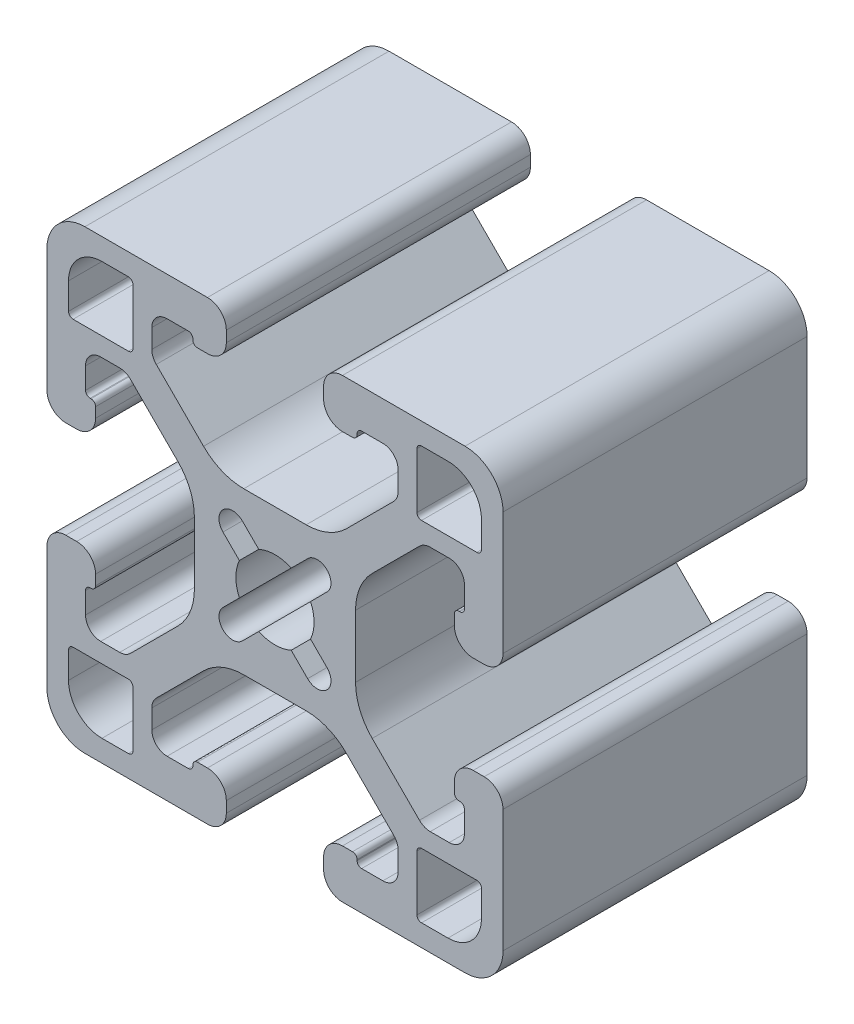
from build123d import *

# Parameters (mm, degrees)
EXTRUDE1_DEPTH = 25.4


with BuildPart() as part:
    # Sketch1 → Extrude1 (new body)
    with BuildSketch(Plane.XY):
        with BuildLine():
            Line((-46.536752228, -7.000622168), (-46.536752228, -8.774580164))
            ThreePointArc((-46.536752228, -8.774580164), (-46.907290083, -9.675221514), (-47.806745776, -10.048628264))
            Line((-47.806745776, -10.048628264), (-49.392633083, -10.048628264))
            ThreePointArc((-49.392633083, -10.048628264), (-49.878641042, -9.95195527), (-50.290658695, -9.676653876))
            Line((-50.290658695, -9.676653876), (-54.238761565, -5.728551005))
            ThreePointArc((-54.238761565, -5.728551005), (-55.26838878, -4.187604983), (-55.629945776, -2.369935216))
            Line((-55.629945776, -2.369935216), (-55.629945776, 2.846678689))
            ThreePointArc((-55.629945776, 2.846678689), (-55.26838878, 4.664348456), (-54.238761565, 6.205294478))
            Line((-54.238761565, 6.205294478), (-50.290658695, 10.153397348))
            ThreePointArc((-50.290658695, 10.153397348), (-49.878641042, 10.428698742), (-49.392633083, 10.525371736))
            Line((-49.392633083, 10.525371736), (-47.806745776, 10.525371736))
            ThreePointArc((-47.806745776, 10.525371736), (-46.907290079, 10.151964982), (-46.536752228, 9.251323623))
            Line((-46.536752228, 9.251323623), (-46.536752228, 7.47736564))
            ThreePointArc((-46.536752228, 7.47736564), (-46.648344767, 7.207957418), (-46.91775299, 7.096364878))
            Line((-46.91775299, 7.096364878), (-46.993953142, 7.096364878))
            ThreePointArc((-46.993953142, 7.096364878), (-47.263362671, 6.984771032), (-47.374953904, 6.715360422))
            Line((-47.374953904, 6.715360422), (-47.374945776, 5.877156465))
            ThreePointArc((-47.374945776, 5.877156465), (-46.913692136, 4.763614578), (-45.800145776, 4.302371736))
            Line((-45.800145776, 4.302371736), (-44.885745776, 4.302371736))
            ThreePointArc((-44.885745776, 4.302371736), (-43.772194017, 4.763619977), (-43.310945776, 5.877171736))
            Line((-43.310945776, 5.877171736), (-43.310945776, 16.113371736))
            ThreePointArc((-43.310945776, 16.113371736), (-44.240881746, 18.358435766), (-46.485945776, 19.288371736))
            Line((-46.485945776, 19.288371736), (-56.722145776, 19.288371736))
            ThreePointArc((-56.722145776, 19.288371736), (-57.835697535, 18.827123495), (-58.296945776, 17.713571736))
            Line((-58.296945776, 17.713571736), (-58.296945776, 16.799171736))
            ThreePointArc((-58.296945776, 16.799171736), (-57.835702934, 15.685625376), (-56.722161047, 15.224371736))
            Line((-56.722161047, 15.224371736), (-55.883957091, 15.224363608))
            ThreePointArc((-55.883957091, 15.224363608), (-55.61454648, 15.335954841), (-55.502952634, 15.60536437))
            Line((-55.502952634, 15.60536437), (-55.502952634, 15.681564523))
            ThreePointArc((-55.502952634, 15.681564523), (-55.391360095, 15.950972745), (-55.121951872, 16.062565285))
            Line((-55.121951872, 16.062565285), (-53.347993876, 16.062565285))
            ThreePointArc((-53.347993876, 16.062565285), (-52.447352526, 15.692027429), (-52.073945776, 14.792571736))
            Line((-52.073945776, 14.792571736), (-52.073945776, 13.206684429))
            ThreePointArc((-52.073945776, 13.206684429), (-52.17061877, 12.72067647), (-52.445920164, 12.308658817))
            Line((-52.445920164, 12.308658817), (-56.394023034, 8.360555947))
            ThreePointArc((-56.394023034, 8.360555947), (-57.934969057, 7.330928733), (-59.752638824, 6.969371736))
            Line((-59.752638824, 6.969371736), (-64.969252728, 6.969371736))
            ThreePointArc((-64.969252728, 6.969371736), (-66.786922496, 7.330928733), (-68.327868518, 8.360555947))
            Line((-68.327868518, 8.360555947), (-72.275971388, 12.308658817))
            ThreePointArc((-72.275971388, 12.308658817), (-72.551272782, 12.72067647), (-72.647945776, 13.206684429))
            Line((-72.647945776, 13.206684429), (-72.647945776, 14.792571736))
            ThreePointArc((-72.647945776, 14.792571736), (-72.274539022, 15.692027434), (-71.373897663, 16.062565285))
            Line((-71.373897663, 16.062565285), (-69.59993968, 16.062565285))
            ThreePointArc((-69.59993968, 16.062565285), (-69.330531458, 15.950972745), (-69.218938918, 15.681564523))
            Line((-69.218938918, 15.681564523), (-69.218938918, 15.60536437))
            ThreePointArc((-69.218938918, 15.60536437), (-69.107345072, 15.335954841), (-68.837934461, 15.224363608))
            Line((-68.837934461, 15.224363608), (-67.999730505, 15.224371736))
            ThreePointArc((-67.999730505, 15.224371736), (-66.886188618, 15.685625376), (-66.424945776, 16.799171736))
            Line((-66.424945776, 16.799171736), (-66.424945776, 17.713571736))
            ThreePointArc((-66.424945776, 17.713571736), (-66.886194017, 18.827123495), (-67.999745776, 19.288371736))
            Line((-67.999745776, 19.288371736), (-78.235945776, 19.288371736))
            ThreePointArc((-78.235945776, 19.288371736), (-80.481009806, 18.358435766), (-81.410945776, 16.113371736))
            Line((-81.410945776, 16.113371736), (-81.410945776, 5.877171736))
            ThreePointArc((-81.410945776, 5.877171736), (-80.949697535, 4.763619977), (-79.836145776, 4.302371736))
            Line((-79.836145776, 4.302371736), (-78.921745776, 4.302371736))
            ThreePointArc((-78.921745776, 4.302371736), (-77.808199416, 4.763614578), (-77.346945776, 5.877156465))
            Line((-77.346945776, 5.877156465), (-77.346937648, 6.715360422))
            ThreePointArc((-77.346937648, 6.715360422), (-77.458528881, 6.984771032), (-77.72793841, 7.096364878))
            Line((-77.72793841, 7.096364878), (-77.804138562, 7.096364878))
            ThreePointArc((-77.804138562, 7.096364878), (-78.073546785, 7.207957418), (-78.185139324, 7.47736564))
            Line((-78.185139324, 7.47736564), (-78.185139324, 9.251323637))
            ThreePointArc((-78.185139324, 9.251323637), (-77.814601469, 10.151964987), (-76.915145776, 10.525371736))
            Line((-76.915145776, 10.525371736), (-75.329258469, 10.525371736))
            ThreePointArc((-75.329258469, 10.525371736), (-74.84325051, 10.428698742), (-74.431232857, 10.153397348))
            Line((-74.431232857, 10.153397348), (-70.483129987, 6.205294478))
            ThreePointArc((-70.483129987, 6.205294478), (-69.453502773, 4.664348456), (-69.091945776, 2.846678689))
            Line((-69.091945776, 2.846678689), (-69.091945776, -2.369935216))
            ThreePointArc((-69.091945776, -2.369935216), (-69.453502773, -4.187604983), (-70.483129987, -5.728551005))
            Line((-70.483129987, -5.728551005), (-74.431232857, -9.676653876))
            ThreePointArc((-74.431232857, -9.676653876), (-74.84325051, -9.95195527), (-75.329258469, -10.048628264))
            Line((-75.329258469, -10.048628264), (-76.915145776, -10.048628264))
            ThreePointArc((-76.915145776, -10.048628264), (-77.814601474, -9.67522151), (-78.185139324, -8.774580151))
            Line((-78.185139324, -8.774580151), (-78.185139324, -7.000622168))
            ThreePointArc((-78.185139324, -7.000622168), (-78.073546785, -6.731213945), (-77.804138562, -6.619621406))
            Line((-77.804138562, -6.619621406), (-77.72793841, -6.619621406))
            ThreePointArc((-77.72793841, -6.619621406), (-77.458528881, -6.50802756), (-77.346937648, -6.238616949))
            Line((-77.346937648, -6.238616949), (-77.346945776, -5.400412993))
            ThreePointArc((-77.346945776, -5.400412993), (-77.808199416, -4.286871106), (-78.921745776, -3.825628264))
            Line((-78.921745776, -3.825628264), (-79.836145776, -3.825628264))
            ThreePointArc((-79.836145776, -3.825628264), (-80.949697535, -4.286876505), (-81.410945776, -5.400428264))
            Line((-81.410945776, -5.400428264), (-81.410945776, -15.636628264))
            ThreePointArc((-81.410945776, -15.636628264), (-80.481009806, -17.881692294), (-78.235945776, -18.811628264))
            Line((-78.235945776, -18.811628264), (-67.999745776, -18.811628264))
            ThreePointArc((-67.999745776, -18.811628264), (-66.886194017, -18.350380023), (-66.424945776, -17.236828264))
            Line((-66.424945776, -17.236828264), (-66.424945776, -16.322428264))
            ThreePointArc((-66.424945776, -16.322428264), (-66.886188618, -15.208881904), (-67.999730505, -14.747628264))
            Line((-67.999730505, -14.747628264), (-68.837934461, -14.747620136))
            ThreePointArc((-68.837934461, -14.747620136), (-69.107345072, -14.859211369), (-69.218938918, -15.128620898))
            Line((-69.218938918, -15.128620898), (-69.218938918, -15.20482105))
            ThreePointArc((-69.218938918, -15.20482105), (-69.330531458, -15.474229273), (-69.59993968, -15.585821812))
            Line((-69.59993968, -15.585821812), (-71.373897676, -15.585821812))
            ThreePointArc((-71.373897676, -15.585821812), (-72.274539027, -15.215283957), (-72.647945776, -14.315828264))
            Line((-72.647945776, -14.315828264), (-72.647945776, -12.729940957))
            ThreePointArc((-72.647945776, -12.729940957), (-72.551272782, -12.243932998), (-72.275971388, -11.831915345))
            Line((-72.275971388, -11.831915345), (-68.327868518, -7.883812475))
            ThreePointArc((-68.327868518, -7.883812475), (-66.786922496, -6.85418526), (-64.969252728, -6.492628264))
            Line((-64.969252728, -6.492628264), (-59.752638824, -6.492628264))
            ThreePointArc((-59.752638824, -6.492628264), (-57.934969057, -6.85418526), (-56.394023034, -7.883812475))
            Line((-56.394023034, -7.883812475), (-52.445920164, -11.831915345))
            ThreePointArc((-52.445920164, -11.831915345), (-52.17061877, -12.243932998), (-52.073945776, -12.729940957))
            Line((-52.073945776, -12.729940957), (-52.073945776, -14.315828264))
            ThreePointArc((-52.073945776, -14.315828264), (-52.44735253, -15.215283961), (-53.347993889, -15.585821812))
            Line((-53.347993889, -15.585821812), (-55.121951872, -15.585821812))
            ThreePointArc((-55.121951872, -15.585821812), (-55.391360095, -15.474229273), (-55.502952634, -15.20482105))
            Line((-55.502952634, -15.20482105), (-55.502952634, -15.128620898))
            ThreePointArc((-55.502952634, -15.128620898), (-55.61454648, -14.859211369), (-55.883957091, -14.747620136))
            Line((-55.883957091, -14.747620136), (-56.722161047, -14.747628264))
            ThreePointArc((-56.722161047, -14.747628264), (-57.835702934, -15.208881904), (-58.296945776, -16.322428264))
            Line((-58.296945776, -16.322428264), (-58.296945776, -17.236828264))
            ThreePointArc((-58.296945776, -17.236828264), (-57.835697535, -18.350380023), (-56.722145776, -18.811628264))
            Line((-56.722145776, -18.811628264), (-46.485945776, -18.811628264))
            ThreePointArc((-46.485945776, -18.811628264), (-44.240881746, -17.881692294), (-43.310945776, -15.636628264))
            Line((-43.310945776, -15.636628264), (-43.310945776, -5.400428264))
            ThreePointArc((-43.310945776, -5.400428264), (-43.772194017, -4.286876505), (-44.885745776, -3.825628264))
            Line((-44.885745776, -3.825628264), (-45.800145776, -3.825628264))
            ThreePointArc((-45.800145776, -3.825628264), (-46.913692136, -4.286871106), (-47.374945776, -5.400412993))
            Line((-47.374945776, -5.400412993), (-47.374953904, -6.238616949))
            ThreePointArc((-47.374953904, -6.238616949), (-47.263362671, -6.50802756), (-46.993953142, -6.619621406))
            Line((-46.993953142, -6.619621406), (-46.91775299, -6.619621406))
            ThreePointArc((-46.91775299, -6.619621406), (-46.648344767, -6.731213945), (-46.536752228, -7.000622168))
        make_face()
        with BuildLine():
            Line((-66.704246649, -2.488483035), (-65.333825803, -1.118062189))
            ThreePointArc((-65.333825803, -1.118062189), (-65.628655776, 0.238371736), (-65.333825803, 1.594805661))
            Line((-65.333825803, 1.594805661), (-66.704246649, 2.965226507))
            ThreePointArc((-66.704246649, 2.965226507), (-66.704246649, 4.581672609), (-65.087800547, 4.581672609))
            Line((-65.087800547, 4.581672609), (-63.717379701, 3.211251763))
            ThreePointArc((-63.717379701, 3.211251763), (-62.360945776, 3.506081736), (-61.004511851, 3.211251763))
            Line((-61.004511851, 3.211251763), (-59.721184579, 4.483982556))
            ThreePointArc((-59.721184579, 4.483982556), (-58.017644903, 4.581672609), (-58.115334956, 2.878132934))
            Line((-58.115334956, 2.878132934), (-59.38806575, 1.594805661))
            ThreePointArc((-59.38806575, 1.594805661), (-59.093235776, 0.238371736), (-59.38806575, -1.118062189))
            Line((-59.38806575, -1.118062189), (-58.017644903, -2.488483035))
            ThreePointArc((-58.017644903, -2.488483035), (-58.017644903, -4.104929137), (-59.634091005, -4.104929137))
            Line((-59.634091005, -4.104929137), (-61.004511851, -2.73450829))
            ThreePointArc((-61.004511851, -2.73450829), (-62.360945776, -3.029338264), (-63.717379701, -2.73450829))
            Line((-63.717379701, -2.73450829), (-65.087800547, -4.104929137))
            ThreePointArc((-65.087800547, -4.104929137), (-66.704246649, -4.104929137), (-66.704246649, -2.488483035))
        make_face(mode=Mode.SUBTRACT)
        with BuildLine():
            Line((-79.607545776, 12.481171736), (-79.607545776, 14.690971736))
            ThreePointArc((-79.607545776, 14.690971736), (-78.789202123, 16.666628083), (-76.813545776, 17.484971736))
            Line((-76.813545776, 17.484971736), (-74.603745776, 17.484971736))
            ThreePointArc((-74.603745776, 17.484971736), (-74.334338092, 17.37337942), (-74.222745776, 17.103971736))
            Line((-74.222745776, 17.103971736), (-74.222745776, 12.481171736))
            ThreePointArc((-74.222745776, 12.481171736), (-74.334338092, 12.211764053), (-74.603745776, 12.100171736))
            Line((-74.603745776, 12.100171736), (-79.226545776, 12.100171736))
            ThreePointArc((-79.226545776, 12.100171736), (-79.49595346, 12.211764053), (-79.607545776, 12.481171736))
        make_face(mode=Mode.SUBTRACT)
        with BuildLine():
            Line((-74.603745776, -17.008228264), (-76.813545776, -17.008228264))
            ThreePointArc((-76.813545776, -17.008228264), (-78.789202123, -16.18988461), (-79.607545776, -14.214228264))
            Line((-79.607545776, -14.214228264), (-79.607545776, -12.004428264))
            ThreePointArc((-79.607545776, -12.004428264), (-79.49595346, -11.73502058), (-79.226545776, -11.623428264))
            Line((-79.226545776, -11.623428264), (-74.603745776, -11.623428264))
            ThreePointArc((-74.603745776, -11.623428264), (-74.334338092, -11.73502058), (-74.222745776, -12.004428264))
            Line((-74.222745776, -12.004428264), (-74.222745776, -16.627228264))
            ThreePointArc((-74.222745776, -16.627228264), (-74.334338092, -16.896635947), (-74.603745776, -17.008228264))
        make_face(mode=Mode.SUBTRACT)
        with BuildLine():
            Line((-45.114345776, -12.004428264), (-45.114345776, -14.214228264))
            ThreePointArc((-45.114345776, -14.214228264), (-45.932689429, -16.18988461), (-47.908345776, -17.008228264))
            Line((-47.908345776, -17.008228264), (-50.118145776, -17.008228264))
            ThreePointArc((-50.118145776, -17.008228264), (-50.38755346, -16.896635947), (-50.499145776, -16.627228264))
            Line((-50.499145776, -16.627228264), (-50.499145776, -12.004428264))
            ThreePointArc((-50.499145776, -12.004428264), (-50.38755346, -11.73502058), (-50.118145776, -11.623428264))
            Line((-50.118145776, -11.623428264), (-45.495345776, -11.623428264))
            ThreePointArc((-45.495345776, -11.623428264), (-45.225938092, -11.73502058), (-45.114345776, -12.004428264))
        make_face(mode=Mode.SUBTRACT)
        with BuildLine():
            Line((-50.118145776, 17.484971736), (-47.908345776, 17.484971736))
            ThreePointArc((-47.908345776, 17.484971736), (-45.932689429, 16.666628083), (-45.114345776, 14.690971736))
            Line((-45.114345776, 14.690971736), (-45.114345776, 12.481171736))
            ThreePointArc((-45.114345776, 12.481171736), (-45.225938092, 12.211764053), (-45.495345776, 12.100171736))
            Line((-45.495345776, 12.100171736), (-50.118145776, 12.100171736))
            ThreePointArc((-50.118145776, 12.100171736), (-50.38755346, 12.211764053), (-50.499145776, 12.481171736))
            Line((-50.499145776, 12.481171736), (-50.499145776, 17.103971736))
            ThreePointArc((-50.499145776, 17.103971736), (-50.38755346, 17.37337942), (-50.118145776, 17.484971736))
        make_face(mode=Mode.SUBTRACT)
    extrude(amount=-EXTRUDE1_DEPTH)


solid = part.part
